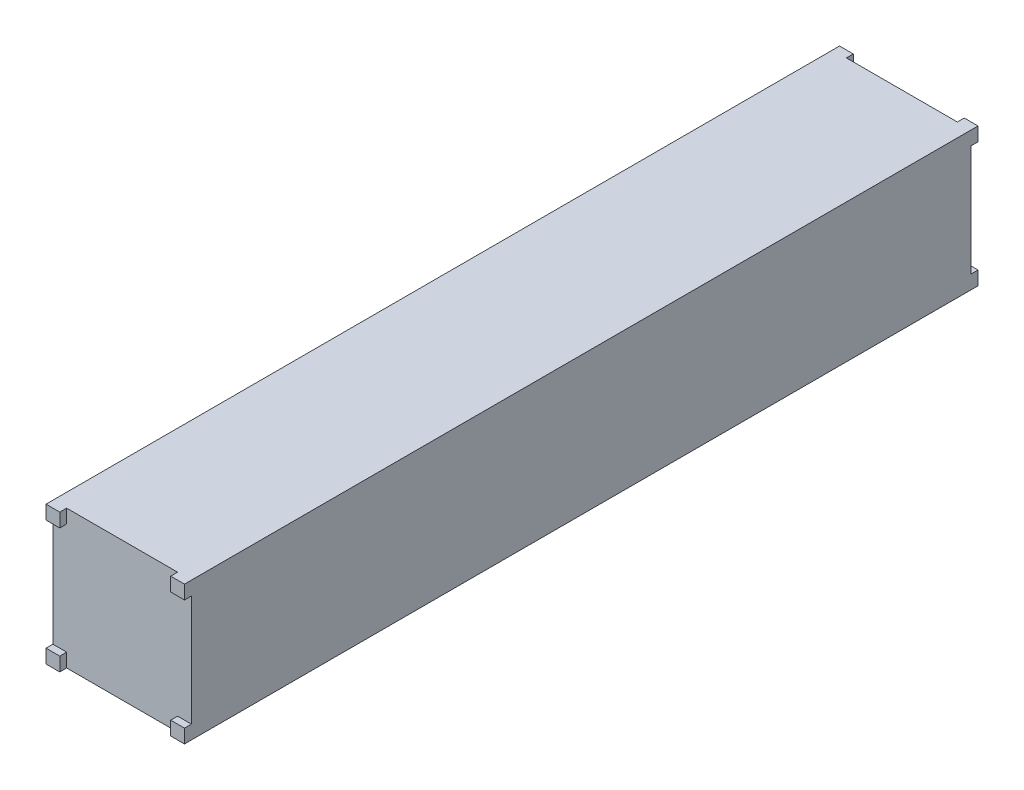
from build123d import *

# Parameters (mm, degrees)
SKETCH1_W           = 100.6
SKETCH1_H           = 100.6
BOSS_EXTRUDE1_DEPTH = 283.25
SKETCH2_W           = 10
SKETCH2_H           = 10
BOSS_EXTRUDE2_DEPTH = 5
SKETCH3_W           = 10
SKETCH3_H           = 10
BOSS_EXTRUDE3_DEPTH = 5


with BuildPart() as part:
    # Sketch1 → Boss-Extrude1 (new, symmetric)
    with BuildSketch(Plane.XY):
        Rectangle(SKETCH1_W, SKETCH1_H)
    extrude(amount=BOSS_EXTRUDE1_DEPTH, both=True)

    # Sketch2 → Boss-Extrude2 (add)
    with BuildSketch(Plane.XY.offset(283.25)):
        with Locations((-45.3, 45.3)):
            Rectangle(SKETCH2_W, SKETCH2_H)
        with Locations((45.3, 45.3)):
            Rectangle(SKETCH2_W, SKETCH2_H)
        with Locations((45.3, -45.3)):
            Rectangle(SKETCH2_W, SKETCH2_H)
        with Locations((-45.3, -45.3)):
            Rectangle(SKETCH2_W, SKETCH2_H)
    extrude(amount=BOSS_EXTRUDE2_DEPTH)

    # Sketch3 → Boss-Extrude3 (add)
    with BuildSketch(Plane(origin=(0, 0, -283.25), x_dir=(-1, 0, 0), z_dir=(0, 0, -1))):
        with Locations((-45.3, 45.3)):
            Rectangle(SKETCH3_W, SKETCH3_H)
        with Locations((45.3, 45.3)):
            Rectangle(SKETCH3_W, SKETCH3_H)
        with Locations((45.3, -45.3)):
            Rectangle(SKETCH3_W, SKETCH3_H)
        with Locations((-45.3, -45.3)):
            Rectangle(SKETCH3_W, SKETCH3_H)
    extrude(amount=BOSS_EXTRUDE3_DEPTH)


solid = part.part
